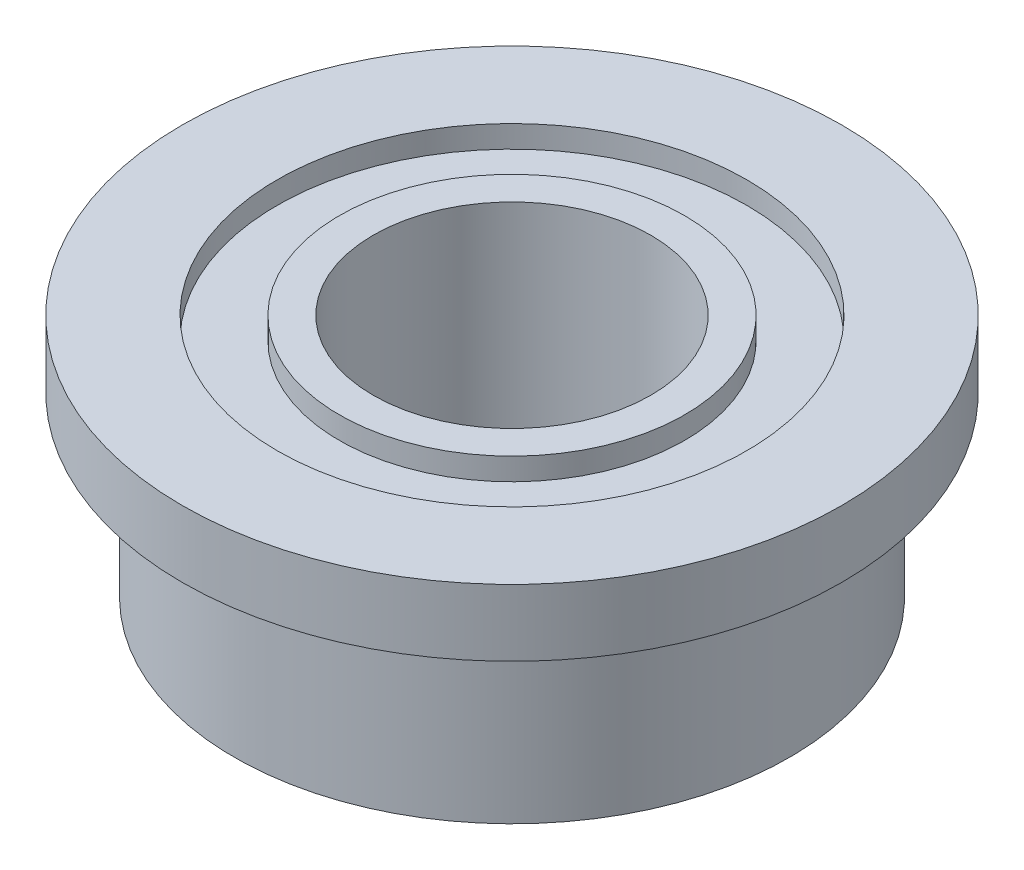
from build123d import *


with BuildPart() as part:
    # Sketch1 → Revolve1 (revolve)
    with BuildSketch(Plane.XY, mode=Mode.PRIVATE) as revolve1_sk:
        Polygon((1.97485, 0.254), (2.68605, 0.254), (2.68605, 0), (3.175, 0), (3.175, 1.7272), (3.0734, 1.7272), (3.0734, 2.032), (3.7719, 2.032), (3.7719, 2.794), (2.68605, 2.794), (2.68605, 2.54), (1.97485, 2.54), (1.97485, 2.794), (1.5875, 2.794), (1.5875, 0), (1.97485, 0), align=None)
    revolve(revolve1_sk.sketch.rotate(Axis((0, 2.794, 0), (0, -1, 0)), 270), axis=Axis((0, 2.794, 0), (0, -1, 0)))


solid = part.part
